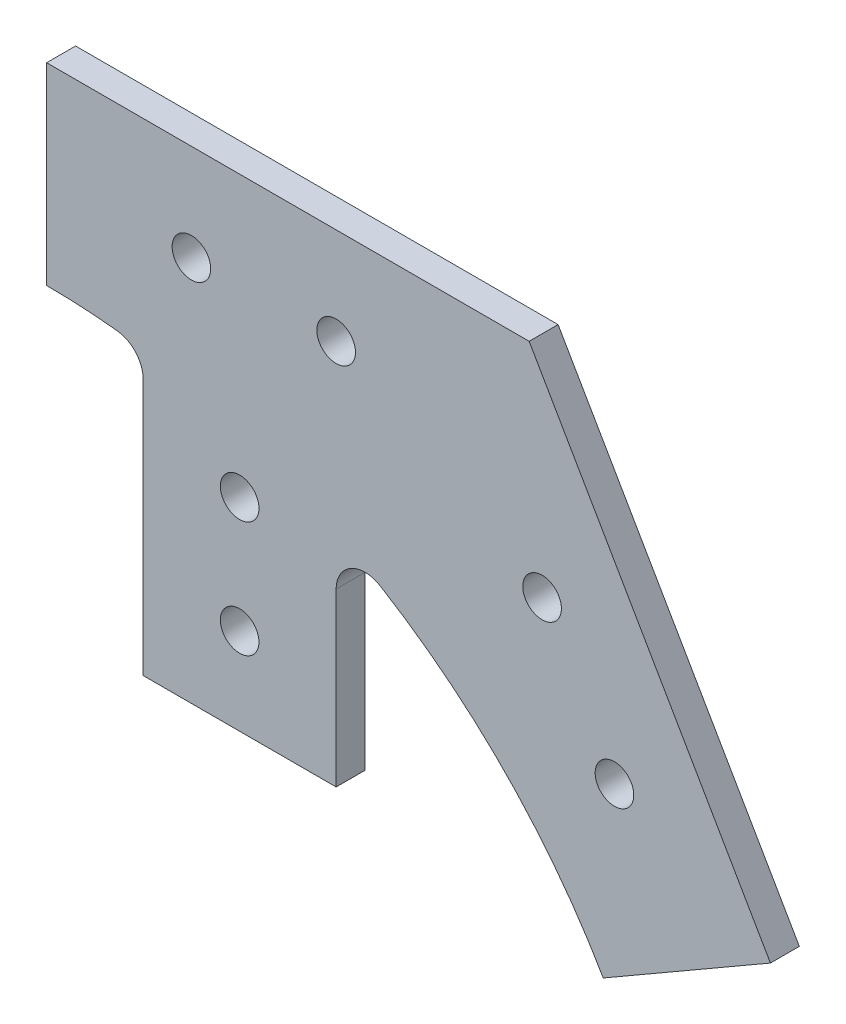
from build123d import *

# Parameters (mm, degrees)
SKETCH_1_R      = 2
EXTRUDE_1_DEPTH = 3


with BuildPart() as part:
    # 草图1 → 凸台-拉伸1 (new body)
    with BuildSketch(Plane.XY):
        with BuildLine():
            Line((-22.324440756, -1.353097581), (-22.324440756, -27.966719239))
            Line((-22.324440756, -27.966719239), (-2.324440756, -27.966719239))
            Line((-2.324440756, -27.966719239), (-2.324440756, -10.197546911))
            ThreePointArc((-2.324440756, -10.197546911), (-0.7958984, -7.583199497), (2.232100844, -7.632945919))
            ThreePointArc((2.232100844, -7.632945919), (15.283597331, -17.99273018), (25.355051168, -31.267989428))
            Line((25.355051168, -31.267989428), (42.675559244, -21.267989428))
            Line((42.675559244, -21.267989428), (17.675559244, 22.033280761))
            Line((17.675559244, 22.033280761), (-32.324440756, 22.033280761))
            Line((-32.324440756, 22.033280761), (-32.324440756, 2.033280761))
            ThreePointArc((-32.324440756, 2.033280761), (-28.653774048, 1.932053083), (-24.994265265, 1.628677754))
            ThreePointArc((-24.994265265, 1.628677754), (-23.089432202, 0.64808626), (-22.324440756, -1.353097581))
        make_face()
        with Locations((-17.324440756, 12.033280761)):
            Circle(SKETCH_1_R, mode=Mode.SUBTRACT)
        with Locations((-2.324440756, 12.033280761)):
            Circle(SKETCH_1_R, mode=Mode.SUBTRACT)
        with Locations((19.015305206, -0.287227314)):
            Circle(SKETCH_1_R, mode=Mode.SUBTRACT)
        with Locations((26.515305206, -13.277608371)):
            Circle(SKETCH_1_R, mode=Mode.SUBTRACT)
        with Locations((-12.324440756, -18.966719239)):
            Circle(SKETCH_1_R, mode=Mode.SUBTRACT)
        with Locations((-12.324440756, -6.966719239)):
            Circle(SKETCH_1_R, mode=Mode.SUBTRACT)
    extrude(amount=EXTRUDE_1_DEPTH)


solid = part.part
